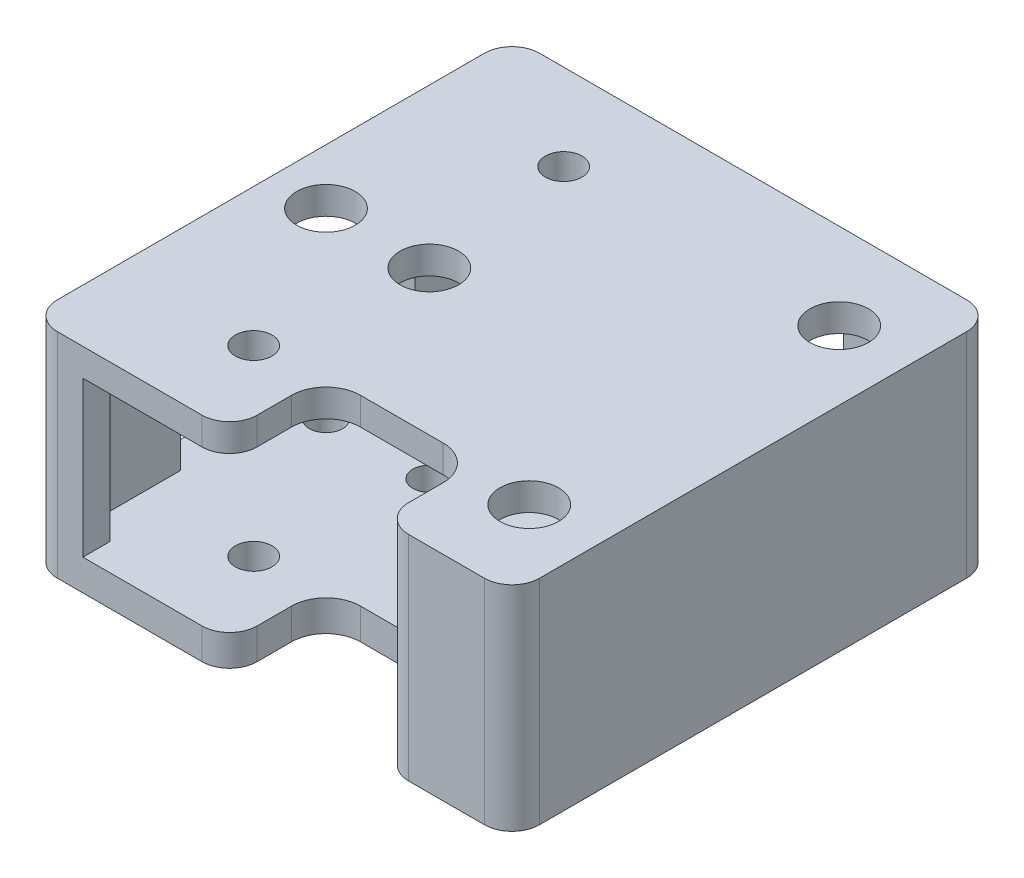
from build123d import *

# Parameters (mm, degrees)
SKETCH1_R           = 2.6605
SKETCH1_R_2         = 2.41215
BOSS_EXTRUDE1_DEPTH = 4.5
BOSS_EXTRUDE2_DEPTH = 22.5
SKETCH3_R           = 2.6605
SKETCH3_R_2         = 4.25
BOSS_EXTRUDE3_DEPTH = 4
CUT_EXTRUDE2_DEPTH  = 59.403767002
FILLET1_R           = 4


with BuildPart() as part:
    # Sketch1 → Boss-Extrude1 (new body)
    with BuildSketch(Plane(origin=(0, 0, 0), x_dir=(1, 0, 0), z_dir=(0, 1, 0))):
        with BuildLine():
            Line((-31, -35), (31, -35))
            ThreePointArc((31, -35), (33.828427125, -33.828427125), (35, -31))
            Line((35, -31), (35, 31))
            ThreePointArc((35, 31), (33.828427125, 33.828427125), (31, 35))
            Line((31, 35), (-31, 35))
            ThreePointArc((-31, 35), (-33.828427125, 33.828427125), (-35, 31))
            Line((-35, 31), (-35, -31))
            ThreePointArc((-35, -31), (-33.828427125, -33.828427125), (-31, -35))
        make_face()
        with Locations(Location((25, 22.5, 0), (0, 0, 270))):
            Circle(SKETCH1_R, mode=Mode.SUBTRACT)
        with Locations(Location((25, -22.5, 0), (0, 0, 270))):
            Circle(SKETCH1_R, mode=Mode.SUBTRACT)
        with Locations(Location((-15, -22.5, 0), (0, 0, 270))):
            Circle(SKETCH1_R, mode=Mode.SUBTRACT)
        with Locations(Location((-15, 22.5, 0), (0, 0, 270))):
            Circle(SKETCH1_R, mode=Mode.SUBTRACT)
        with Locations(Location((-12, 0, 0), (0, 0, 270))):
            Circle(SKETCH1_R_2, mode=Mode.SUBTRACT)
        with Locations(Location((-27, 0, 0), (0, 0, 270))):
            Circle(SKETCH1_R_2, mode=Mode.SUBTRACT)
    extrude(amount=BOSS_EXTRUDE1_DEPTH)

    # Sketch2 → Boss-Extrude2 (add)
    with BuildSketch(Plane(origin=(0, 4.5, 0), x_dir=(1, 0, 0), z_dir=(0, 1, 0))):
        with BuildLine():
            Line((-27.289833197, 35), (-31, 35))
            ThreePointArc((-31, 35), (-33.828427125, 33.828427125), (-35, 31))
            Line((-35, 31), (-35, 17))
            Line((-35, 17), (-31.1, 17))
            Line((-31.1, 17), (-31.1, 31))
            ThreePointArc((-31.1, 31), (-31.070710678, 31.070710678), (-31, 31.1))
            Line((-31, 31.1), (-27.289833197, 31.1))
            Line((-27.289833197, 31.1), (-27.289833197, 35))
        make_face()
        with BuildLine():
            Line((-31, -35), (-27.289833197, -35))
            Line((-27.289833197, -35), (-27.289833197, -31.1))
            Line((-27.289833197, -31.1), (-31, -31.1))
            ThreePointArc((-31, -31.1), (-31.070710678, -31.070710678), (-31.1, -31))
            Line((-31.1, -31), (-31.1, -17))
            Line((-31.1, -17), (-35, -17))
            Line((-35, -17), (-35, -31))
            ThreePointArc((-35, -31), (-33.828427125, -33.828427125), (-31, -35))
        make_face()
        with BuildLine():
            Line((17, -35), (31, -35))
            ThreePointArc((31, -35), (33.828427125, -33.828427125), (35, -31))
            Line((35, -31), (35, 31))
            ThreePointArc((35, 31), (33.828427125, 33.828427125), (31, 35))
            Line((31, 35), (17, 35))
            Line((17, 35), (17, 31.1))
            Line((17, 31.1), (31, 31.1))
            ThreePointArc((31, 31.1), (31.070710678, 31.070710678), (31.1, 31))
            Line((31.1, 31), (31.1, -31))
            ThreePointArc((31.1, -31), (31.070710678, -31.070710678), (31, -31.1))
            Line((31, -31.1), (17, -31.1))
            Line((17, -31.1), (17, -35))
        make_face()
    extrude(amount=BOSS_EXTRUDE2_DEPTH)

    # Sketch3 → Boss-Extrude3 (add)
    with BuildSketch(Plane(origin=(0, 27, 0), x_dir=(1, 0, 0), z_dir=(0, 1, 0))):
        with BuildLine():
            Line((-31, 35), (31, 35))
            ThreePointArc((31, 35), (33.828427125, 33.828427125), (35, 31))
            Line((35, 31), (35, -31))
            ThreePointArc((35, -31), (33.828427125, -33.828427125), (31, -35))
            Line((31, -35), (-31, -35))
            ThreePointArc((-31, -35), (-33.828427125, -33.828427125), (-35, -31))
            Line((-35, -31), (-35, 31))
            ThreePointArc((-35, 31), (-33.828427125, 33.828427125), (-31, 35))
        make_face()
        with Locations(Location((-15, 22.5, 0), (0, 0, 270))):
            Circle(SKETCH3_R, mode=Mode.SUBTRACT)
        with Locations(Location((25, 22.5, 0), (0, 0, 270))):
            Circle(SKETCH3_R_2, mode=Mode.SUBTRACT)
        with Locations(Location((25, -22.5, 0), (0, 0, 270))):
            Circle(SKETCH3_R_2, mode=Mode.SUBTRACT)
        with Locations(Location((-15, -22.5, 0), (0, 0, 270))):
            Circle(SKETCH3_R, mode=Mode.SUBTRACT)
        with Locations(Location((-12, 0, 0), (0, 0, 270))):
            Circle(SKETCH3_R_2, mode=Mode.SUBTRACT)
        with Locations(Location((-27, 0, 0), (0, 0, 270))):
            Circle(SKETCH3_R_2, mode=Mode.SUBTRACT)
    extrude(amount=BOSS_EXTRUDE3_DEPTH)

    # Sketch4 → Cut-Extrude2 (cut, through all)
    with BuildSketch(Plane(origin=(0, 0, 0), x_dir=(1, 0, 0), z_dir=(0, 1, 0))):
        with BuildLine():
            Line((-1, -21), (11, -21))
            ThreePointArc((11, -21), (14.535533906, -22.464466094), (16, -26))
            Line((16, -26), (16, -35))
            Line((16, -35), (-6, -35))
            Line((-6, -35), (-6, -26))
            ThreePointArc((-6, -26), (-4.535533906, -22.464466094), (-1, -21))
        make_face()
    extrude(amount=CUT_EXTRUDE2_DEPTH, mode=Mode.SUBTRACT)

    # Fillet1
    fillet1_edges = [part.edges().sort_by_distance(p)[0] for p in [
        (16, 2.25, 35),
        (-6, 2.25, 35),
        (-6, 29, 35),
    ]]
    fillet(fillet1_edges, radius=FILLET1_R)


solid = part.part
